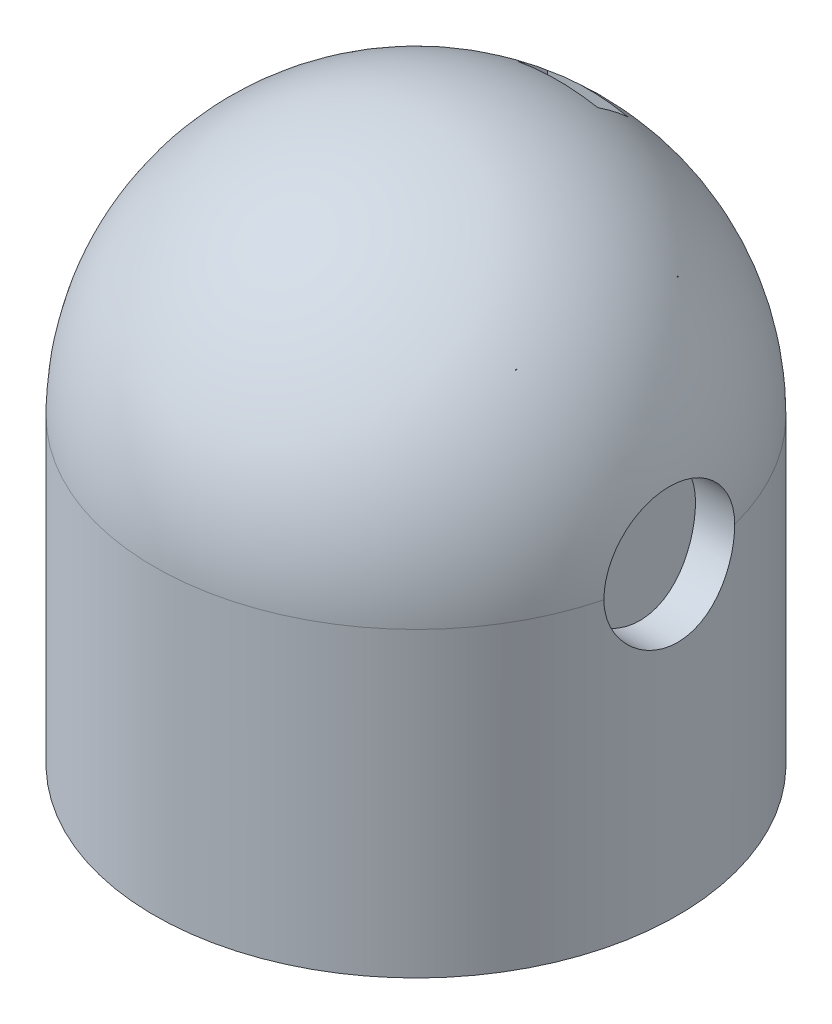
from build123d import *

# Parameters (mm, degrees)
REVOLVE1_ANGLE                  = 180
SKETCH3_R                       = 33.02
BOSS_EXTRUDE1_DEPTH             = 38.1
SHELL1_T                        = -4.7625
CUT_EXTRUDE1_DEPTH              = 61.26815743
CUT_EXTRUDE1_DEPTH_BACK         = 61.26815743
SKETCH4_R                       = 8.255
BOSS_EXTRUDE4_REACH             = 62.268
BOSS_EXTRUDE4_END_RADIUS        = 28.2575
SKETCH5_W                       = 46.08
SKETCH5_H                       = 30.66
SKETCH5_W_2                     = 41
SKETCH5_H_2                     = 20.5
BOSS_EXTRUDE4_DIRECTION_2_DEPTH = 19.05
BOSS_EXTRUDE6_REACH             = 77.786
SKETCH8_W                       = 33.216329336
SKETCH8_H                       = 20.5
SKETCH9_W                       = 5.08
SKETCH9_H                       = 20.5
CUT_EXTRUDE2_DEPTH              = 7.5
SKETCH15_W                      = 3.063670664
SKETCH15_H                      = 20.5
SKETCH15_W_2                    = 7.783670664
CUT_EXTRUDE5_DEPTH              = 76.786126205
SKETCH10_W                      = 10.16
SKETCH10_H                      = 3.81
CUT_EXTRUDE3_DEPTH              = 70.942302745
SKETCH11_W                      = 7.62
SKETCH11_H                      = 12.7
CUT_EXTRUDE4_DEPTH              = 36.83
SKETCH16_W                      = 5.08
SKETCH16_H                      = 5.08
CUT_EXTRUDE6_DEPTH              = 40.64
SKETCH17_W                      = 22.86
SKETCH17_H                      = 6.35
CUT_EXTRUDE7_DEPTH              = 3.81
SKETCH18_W                      = 5.08
SKETCH18_H                      = 12.155
CUT_EXTRUDE8_DEPTH              = 3.81
FILLET1_R                       = 5.08


with BuildPart() as part:
    # Sketch2 → Revolve1 (revolve)
    with BuildSketch(Plane(origin=(0, 0, 0), x_dir=(1, 0, 0), z_dir=(0, 1, 0))):
        with BuildLine():
            Line((-33.02, 0), (33.02, 0))
            ThreePointArc((33.02, 0), (0, 33.02), (-33.02, 0))
        make_face()
    revolve(axis=Axis((-33.02, 0, 0), (1, 0, 0)), revolution_arc=REVOLVE1_ANGLE)

    # Sketch3 → Boss-Extrude1 (add)
    with BuildSketch(Plane.XZ):
        with Locations(Location((0, 0, 0), (0, 0, 90))):
            Circle(SKETCH3_R)
    extrude(amount=BOSS_EXTRUDE1_DEPTH)

    # Shell1
    shell1_openings = [part.faces().sort_by_distance(p)[0] for p in [
        (0, -38.1, 0),
    ]]
    offset(amount=SHELL1_T, openings=shell1_openings, kind=Kind.INTERSECTION)

    # Sketch4 → Cut-Extrude1 (cut, two sides: drawn at the far end of the back side and taken through both)
    with BuildSketch(Plane(origin=(0, 0, 0), x_dir=(0, 0, -1), z_dir=(1, 0, 0)).offset(-CUT_EXTRUDE1_DEPTH_BACK)):
        Circle(SKETCH4_R)
    extrude(amount=CUT_EXTRUDE1_DEPTH + CUT_EXTRUDE1_DEPTH_BACK, mode=Mode.SUBTRACT)

    # Boss-Extrude4: up to this sphere (the profile starts inside it)
    boss_extrude4_end = Location((0, 0, 0)) * Sphere(BOSS_EXTRUDE4_END_RADIUS, mode=Mode.PRIVATE)
    # Sketch5 → Boss-Extrude4 (add, up to the surface)
    with BuildSketch(Plane(origin=(0, 0, 0), x_dir=(1, 0, 0), z_dir=(0, 1, 0)), mode=Mode.PRIVATE) as boss_extrude4_sk1:
        with Locations((2.36, 0)):
            Rectangle(SKETCH5_W, SKETCH5_H)
        with Locations((2.36, 0)):
            Rectangle(SKETCH5_W_2, SKETCH5_H_2, mode=Mode.SUBTRACT)
    boss_extrude4_tool1 = extrude(boss_extrude4_sk1.sketch, amount=BOSS_EXTRUDE4_REACH, mode=Mode.PRIVATE) & boss_extrude4_end
    add(boss_extrude4_tool1.solids().sort_by_distance((2.36, 0, -14.77652))[0])

    # Sketch5 → Boss-Extrude4 direction 2 (add)
    with BuildSketch(Plane(origin=(0, 0, 0), x_dir=(1, 0, 0), z_dir=(0, 1, 0))):
        with Locations((2.36, 0)):
            Rectangle(SKETCH5_W, SKETCH5_H)
        with Locations((2.36, 0)):
            Rectangle(SKETCH5_W_2, SKETCH5_H_2, mode=Mode.SUBTRACT)
    extrude(amount=-BOSS_EXTRUDE4_DIRECTION_2_DEPTH)

    # Sketch8 → Boss-Extrude6 (add, up to next)
    with BuildSketch(Plane(origin=(0, 21.59, 0), x_dir=(1, 0, 0), z_dir=(0, 1, 0)), mode=Mode.PRIVATE) as boss_extrude6_sk1:
        with Locations((-1.531835332, 0)):
            Rectangle(SKETCH8_W, SKETCH8_H)
    boss_extrude6_tool1 = extrude(boss_extrude6_sk1.sketch, amount=BOSS_EXTRUDE6_REACH, mode=Mode.PRIVATE) - part.part
    add(boss_extrude6_tool1.solids().sort_by_distance((-1.531835, 21.59, 0))[0])

    # Sketch9 → Cut-Extrude2 (cut)
    with BuildSketch(Plane.XZ.offset(-21.59)):
        with Locations((-7.345, 0)):
            Rectangle(SKETCH9_W, SKETCH9_H)
    extrude(amount=-CUT_EXTRUDE2_DEPTH, mode=Mode.SUBTRACT)

    # Sketch15 → Cut-Extrude5 (cut, through all)
    with BuildSketch(Plane.XZ.offset(-21.59)):
        with Locations((-16.608164668, 0)):
            Rectangle(SKETCH15_W, SKETCH15_H)
        with Locations((18.968164668, 0)):
            Rectangle(SKETCH15_W_2, SKETCH15_H)
    extrude(amount=CUT_EXTRUDE5_DEPTH, mode=Mode.SUBTRACT)

    # Sketch10 → Cut-Extrude3 (cut, through all)
    with BuildSketch(Plane.XZ.offset(19.05)):
        with Locations((0, -19.775)):
            Rectangle(SKETCH10_W, SKETCH10_H)
    extrude(amount=-CUT_EXTRUDE3_DEPTH, mode=Mode.SUBTRACT)

    # Sketch11 → Cut-Extrude4 (cut)
    with BuildSketch(Plane.XZ.offset(19.05)):
        with Locations((-21.95, 0)):
            Rectangle(SKETCH11_W, SKETCH11_H)
    extrude(amount=-CUT_EXTRUDE4_DEPTH, mode=Mode.SUBTRACT)

    # Sketch16 → Cut-Extrude6 (cut)
    with BuildSketch(Plane(origin=(0, -19.05, 0), x_dir=(-1, 0, 0), z_dir=(0, -1, 0))):
        with Locations((0, 12.79)):
            Rectangle(SKETCH16_W, SKETCH16_H)
    extrude(amount=-CUT_EXTRUDE6_DEPTH, mode=Mode.SUBTRACT)

    # Sketch17 → Cut-Extrude7 (cut)
    with BuildSketch(Plane.XZ.offset(-21.59)):
        with Locations((8.89, 0)):
            Rectangle(SKETCH17_W, SKETCH17_H)
    extrude(amount=-CUT_EXTRUDE7_DEPTH, mode=Mode.SUBTRACT)

    # Sketch18 → Cut-Extrude8 (cut)
    with BuildSketch(Plane.XZ.offset(-21.59)):
        with Locations((0, -9.2525)):
            Rectangle(SKETCH18_W, SKETCH18_H)
    extrude(amount=-CUT_EXTRUDE8_DEPTH, mode=Mode.SUBTRACT)

    # Fillet1
    fillet1_edges = [part.edges().sort_by_distance(p)[0] for p in [
        (-2.54, 23.495, 3.175),
        (2.54, 23.495, -3.175),
    ]]
    fillet(fillet1_edges, radius=FILLET1_R)


solid = part.part
